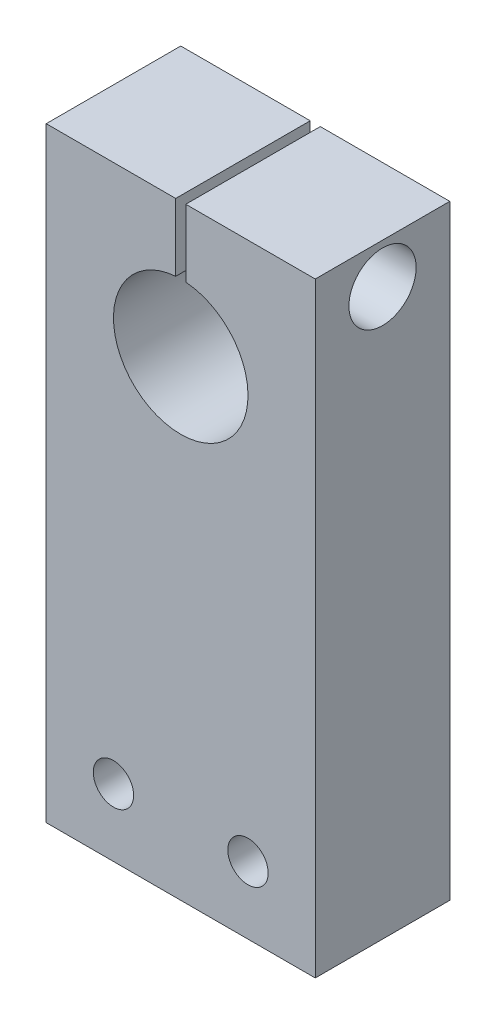
from build123d import *

# Parameters (mm, degrees)
CROQUIS1_R              = 3
SALIENTE_EXTRUIR1_DEPTH = 20
CROQUIS2_R              = 3
CORTAR_EXTRUIR1_DEPTH   = 30
CROQUIS3_R              = 5
CORTAR_EXTRUIR2_DEPTH   = 10


with BuildPart() as part:
    # Croquis1 → Saliente-Extruir1 (new body)
    with BuildSketch(Plane.XY):
        with BuildLine():
            Line((-0.75, 34.971835338), (-0.75, 45))
            Line((-0.75, 45), (-20, 45))
            Line((-20, 45), (-20, -45))
            Line((-20, -45), (20, -45))
            Line((20, -45), (20, 45))
            Line((20, 45), (0.75, 45))
            Line((0.75, 45), (0.75, 34.971835338))
            ThreePointArc((0.75, 34.971835338), (0, 15), (-0.75, 34.971835338))
        make_face()
        with Locations((-10, -35)):
            Circle(CROQUIS1_R, mode=Mode.SUBTRACT)
        with Locations((10, -35)):
            Circle(CROQUIS1_R, mode=Mode.SUBTRACT)
    extrude(amount=SALIENTE_EXTRUIR1_DEPTH)

    # Croquis2 → Cortar-Extruir1 (cut)
    with BuildSketch(Plane(origin=(20, 0, 0), x_dir=(0, 0, -1), z_dir=(1, 0, 0))):
        with Locations((-10, 39)):
            Circle(CROQUIS2_R)
    extrude(amount=-CORTAR_EXTRUIR1_DEPTH, mode=Mode.SUBTRACT)

    # Croquis3 → Cortar-Extruir2 (cut)
    with BuildSketch(Plane(origin=(20, 0, 0), x_dir=(0, 0, -1), z_dir=(1, 0, 0))):
        with Locations((-10, 39)):
            Circle(CROQUIS3_R)
    extrude(amount=-CORTAR_EXTRUIR2_DEPTH, mode=Mode.SUBTRACT)


solid = part.part
